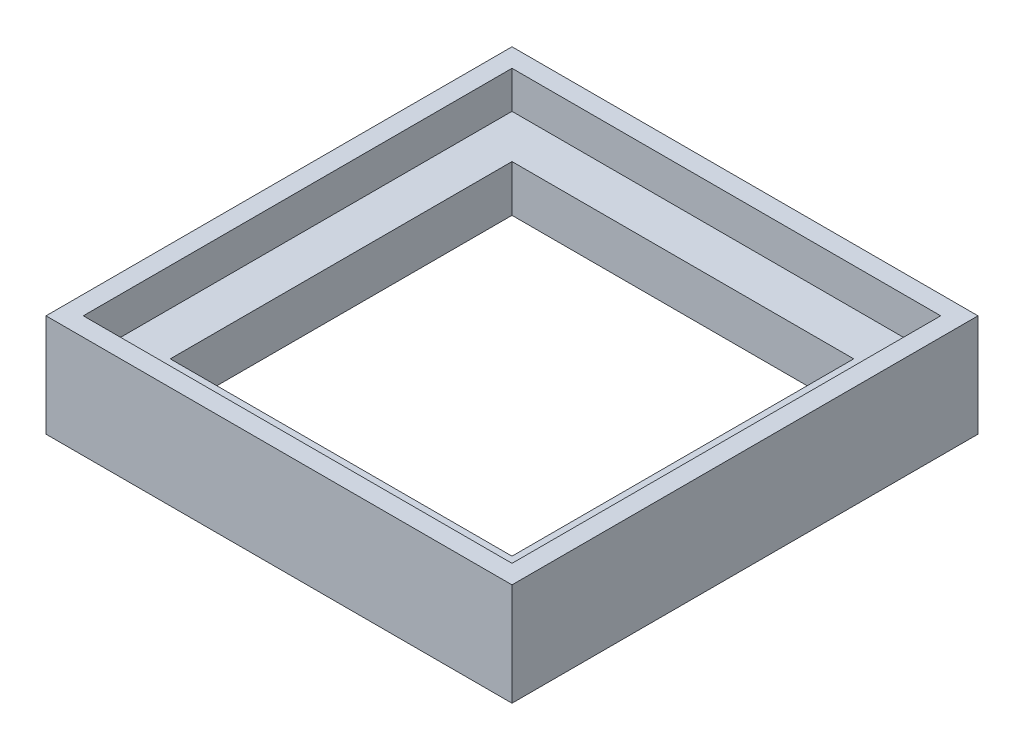
from build123d import *

# Parameters (mm, degrees)
SKETCH_1_W          = 150
SKETCH_1_H          = 150
EXTRUDE_1_DEPTH     = 33
SKETCH_2_W          = 138
SKETCH_2_H          = 138
CUT_EXTRUDE_1_DEPTH = 12
SKETCH_3_W          = 130
SKETCH_3_H          = 130
CUT_EXTRUDE_2_DEPTH = 6
SKETCH_4_W          = 110
SKETCH_4_H          = 110
CUT_EXTRUDE_3_DEPTH = 109.124927746


with BuildPart() as part:
    # Эскиз1 → Бобышка-Вытянуть1 (new body)
    with BuildSketch(Plane(origin=(0, 0, 0), x_dir=(1, 0, 0), z_dir=(0, 1, 0))):
        Rectangle(SKETCH_1_W, SKETCH_1_H)
    extrude(amount=EXTRUDE_1_DEPTH)

    # Эскиз2 → Вырез-Вытянуть1 (cut)
    with BuildSketch(Plane(origin=(0, 33, 0), x_dir=(1, 0, 0), z_dir=(0, 1, 0))):
        Rectangle(SKETCH_2_W, SKETCH_2_H)
    extrude(amount=-CUT_EXTRUDE_1_DEPTH, mode=Mode.SUBTRACT)

    # Эскиз3 → Вырез-Вытянуть2 (cut)
    with BuildSketch(Plane(origin=(0, 0, 0), x_dir=(-1, 0, 0), z_dir=(0, -1, 0))):
        Rectangle(SKETCH_3_W, SKETCH_3_H)
    extrude(amount=-CUT_EXTRUDE_2_DEPTH, mode=Mode.SUBTRACT)

    # Эскиз4 → Вырез-Вытянуть3 (cut, through all)
    with BuildSketch(Plane(origin=(0, 21, 0), x_dir=(1, 0, 0), z_dir=(0, 1, 0))):
        Rectangle(SKETCH_4_W, SKETCH_4_H)
    extrude(amount=-CUT_EXTRUDE_3_DEPTH, mode=Mode.SUBTRACT)


solid = part.part
